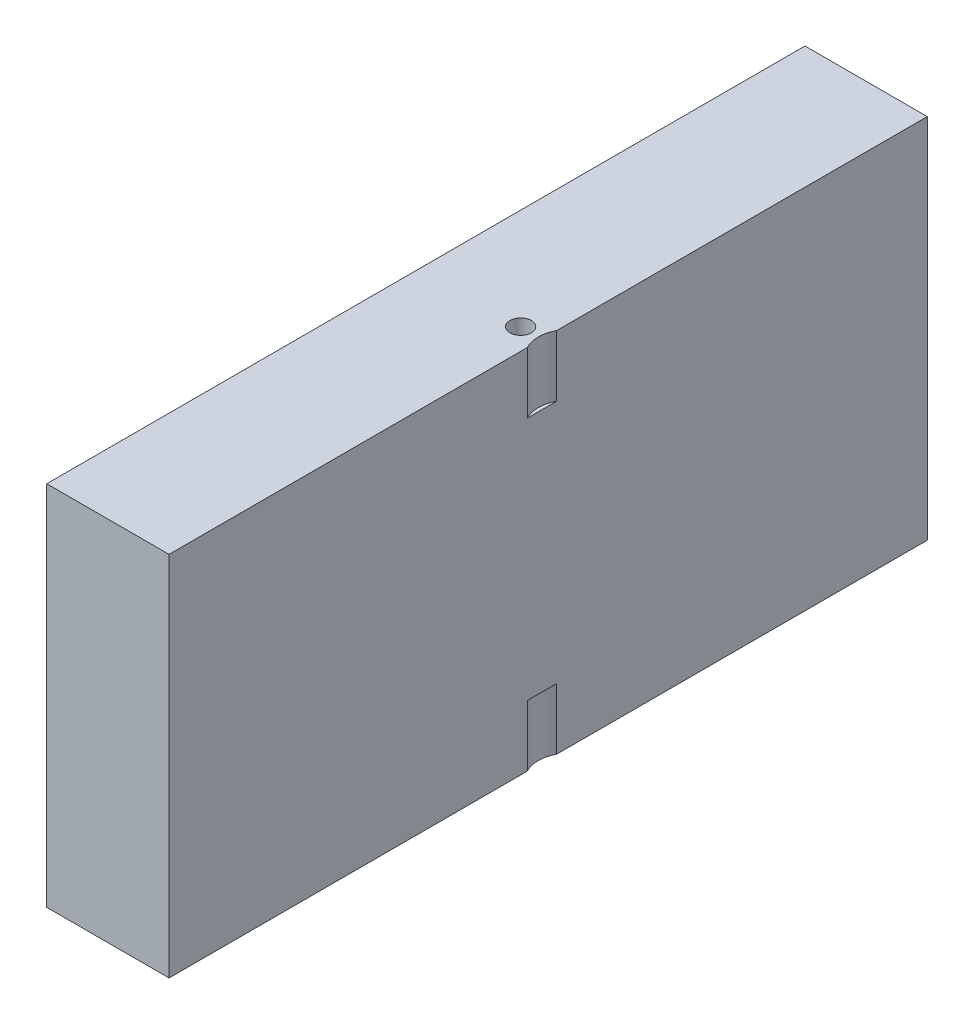
from build123d import *

# Parameters (mm, degrees)
SKETCH1_W           = 20
SKETCH1_H           = 60
BOSS_EXTRUDE1_DEPTH = 62
SKETCH2_R           = 5.1
CUT_EXTRUDE1_DEPTH  = 10
SKETCH3_R           = 4
SKETCH3_R_2         = 1.75
CUT_EXTRUDE2_DEPTH  = 87.856203002


with BuildPart() as part:
    # Sketch1 → Boss-Extrude1 (new, symmetric)
    with BuildSketch(Plane.XY):
        Rectangle(SKETCH1_W, SKETCH1_H)
    extrude(amount=BOSS_EXTRUDE1_DEPTH, both=True)

    # Sketch2 → Cut-Extrude1 (cut)
    with BuildSketch(Plane(origin=(0, 30, 0), x_dir=(1, 0, 0), z_dir=(0, 1, 0))):
        with Locations((14.5, -1)):
            Circle(SKETCH2_R)
    cut_extrude1 = extrude(amount=-CUT_EXTRUDE1_DEPTH, mode=Mode.SUBTRACT)

    # Mirror1: Cut-Extrude1 across plane
    add(cut_extrude1.mirror(Plane.ZX), mode=Mode.SUBTRACT)

    # Sketch3 → Cut-Extrude2 (cut, through all)
    with BuildSketch(Plane(origin=(0, 30, 0), x_dir=(1, 0, 0), z_dir=(0, 1, 0))):
        with Locations((14.5, -1)):
            Circle(SKETCH3_R)
        with Locations(Location((6.5, -1, 0), (0, 0, 270))):
            Circle(SKETCH3_R_2)
        with Locations((14.5, 7)):
            Circle(SKETCH3_R_2)
        with Locations((22.5, -1)):
            Circle(SKETCH3_R_2)
        with Locations((14.5, -9)):
            Circle(SKETCH3_R_2)
    extrude(amount=-CUT_EXTRUDE2_DEPTH, mode=Mode.SUBTRACT)


solid = part.part
